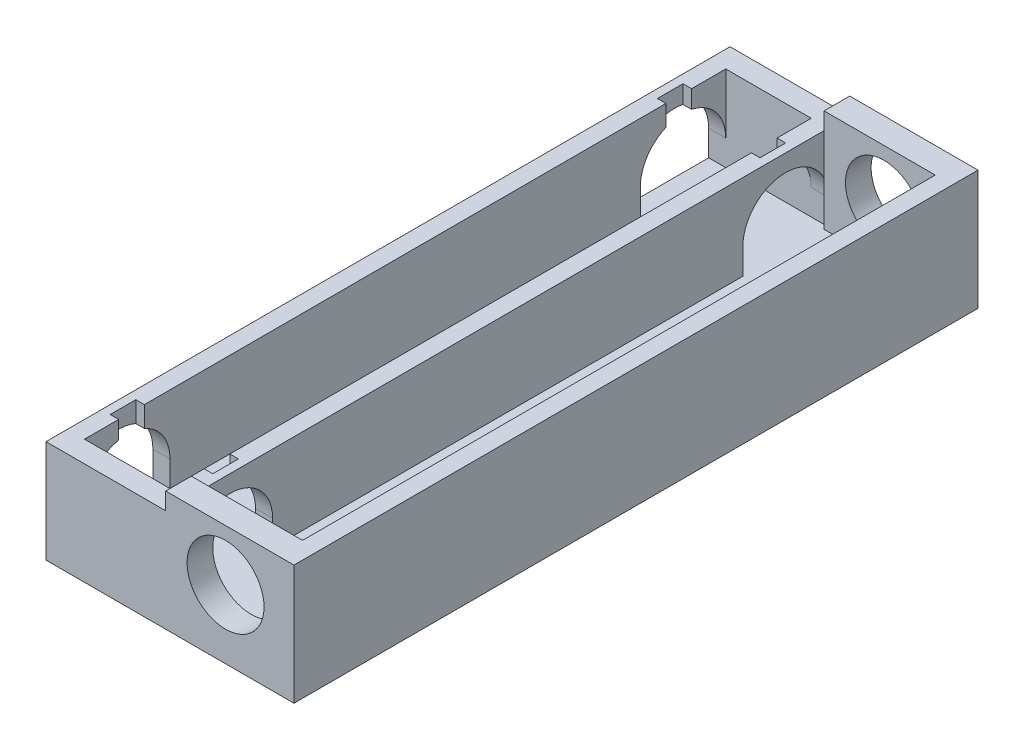
from build123d import *

# Parameters (mm, degrees)
SKETCH1_W           = 14
SKETCH1_H           = 80
BOSS_EXTRUDE1_DEPTH = 2
SKETCH2_W           = 14
SKETCH2_H           = 80
SKETCH2_W_2         = 10
SKETCH2_H_2         = 75
BOSS_EXTRUDE2_DEPTH = 10
SKETCH3_W           = 1
SKETCH3_H           = 3
CUT_EXTRUDE1_DEPTH  = 10
CUT_EXTRUDE2_DEPTH  = 14
SKETCH5_W           = 15
SKETCH5_H           = 80
BOSS_EXTRUDE3_DEPTH = 2
SKETCH6_W           = 15
SKETCH6_H           = 3
BOSS_EXTRUDE4_DEPTH = 12
SKETCH7_R           = 4.5
CUT_EXTRUDE3_DEPTH  = 80
SKETCH8_W           = 2
SKETCH8_H           = 74
BOSS_EXTRUDE5_DEPTH = 12


with BuildPart() as part:
    # Sketch1 → Boss-Extrude1 (new body)
    with BuildSketch(Plane(origin=(0, 0, 0), x_dir=(1, 0, 0), z_dir=(0, 1, 0))):
        Rectangle(SKETCH1_W, SKETCH1_H)
    extrude(amount=BOSS_EXTRUDE1_DEPTH)

    # Sketch2 → Boss-Extrude2 (add)
    with BuildSketch(Plane(origin=(0, 2, 0), x_dir=(1, 0, 0), z_dir=(0, 1, 0))):
        Rectangle(SKETCH2_W, SKETCH2_H)
        Rectangle(SKETCH2_W_2, SKETCH2_H_2, mode=Mode.SUBTRACT)
    extrude(amount=BOSS_EXTRUDE2_DEPTH)

    # Sketch3 → Cut-Extrude1 (cut)
    with BuildSketch(Plane(origin=(0, 12, 0), x_dir=(1, 0, 0), z_dir=(0, 1, 0))):
        with Locations((-5.5, -32)):
            Rectangle(SKETCH3_W, SKETCH3_H)
        with Locations((5.5, -32)):
            Rectangle(SKETCH3_W, SKETCH3_H)
        with Locations((5.5, 32)):
            Rectangle(SKETCH3_W, SKETCH3_H)
        with Locations((-5.5, 32)):
            Rectangle(SKETCH3_W, SKETCH3_H)
    extrude(amount=-CUT_EXTRUDE1_DEPTH, mode=Mode.SUBTRACT)

    # Sketch4 → Cut-Extrude2 (cut)
    with BuildSketch(Plane(origin=(7, 0, 0), x_dir=(0, 0, -1), z_dir=(1, 0, 0))):
        with BuildLine():
            ThreePointArc((-37.5, 5), (-32.5, 10), (-27.5, 5))
            Line((-27.5, 5), (-27.5, 2))
            Line((-27.5, 2), (-32.5, 2))
            Line((-32.5, 2), (-37.5, 2))
            Line((-37.5, 2), (-37.5, 5))
        make_face()
        with BuildLine():
            ThreePointArc((27.5, 5), (32.5, 10), (37.5, 5))
            Line((37.5, 5), (37.5, 2))
            Line((37.5, 2), (32.5, 2))
            Line((32.5, 2), (27.5, 2))
            Line((27.5, 2), (27.5, 5))
        make_face()
    extrude(amount=-CUT_EXTRUDE2_DEPTH, mode=Mode.SUBTRACT)

    # Sketch5 → Boss-Extrude3 (add)
    with BuildSketch(Plane(origin=(0, 0, 0), x_dir=(1, 0, 0), z_dir=(0, 1, 0))):
        with Locations((14.5, 0)):
            Rectangle(SKETCH5_W, SKETCH5_H)
    extrude(amount=BOSS_EXTRUDE3_DEPTH)

    # Sketch6 → Boss-Extrude4 (add)
    with BuildSketch(Plane(origin=(0, 2, 0), x_dir=(1, 0, 0), z_dir=(0, 1, 0))):
        with Locations((14.5, -38.5)):
            Rectangle(SKETCH6_W, SKETCH6_H)
        with Locations((14.5, 38.5)):
            Rectangle(SKETCH6_W, SKETCH6_H)
    extrude(amount=BOSS_EXTRUDE4_DEPTH)

    # Sketch7 → Cut-Extrude3 (cut)
    with BuildSketch(Plane.XY.offset(40)):
        with Locations((14, 8)):
            Circle(SKETCH7_R)
    extrude(amount=-CUT_EXTRUDE3_DEPTH, mode=Mode.SUBTRACT)

    # Sketch8 → Boss-Extrude5 (add)
    with BuildSketch(Plane(origin=(0, 2, 0), x_dir=(1, 0, 0), z_dir=(0, 1, 0))):
        with Locations((21, 0)):
            Rectangle(SKETCH8_W, SKETCH8_H)
    extrude(amount=BOSS_EXTRUDE5_DEPTH)


solid = part.part
